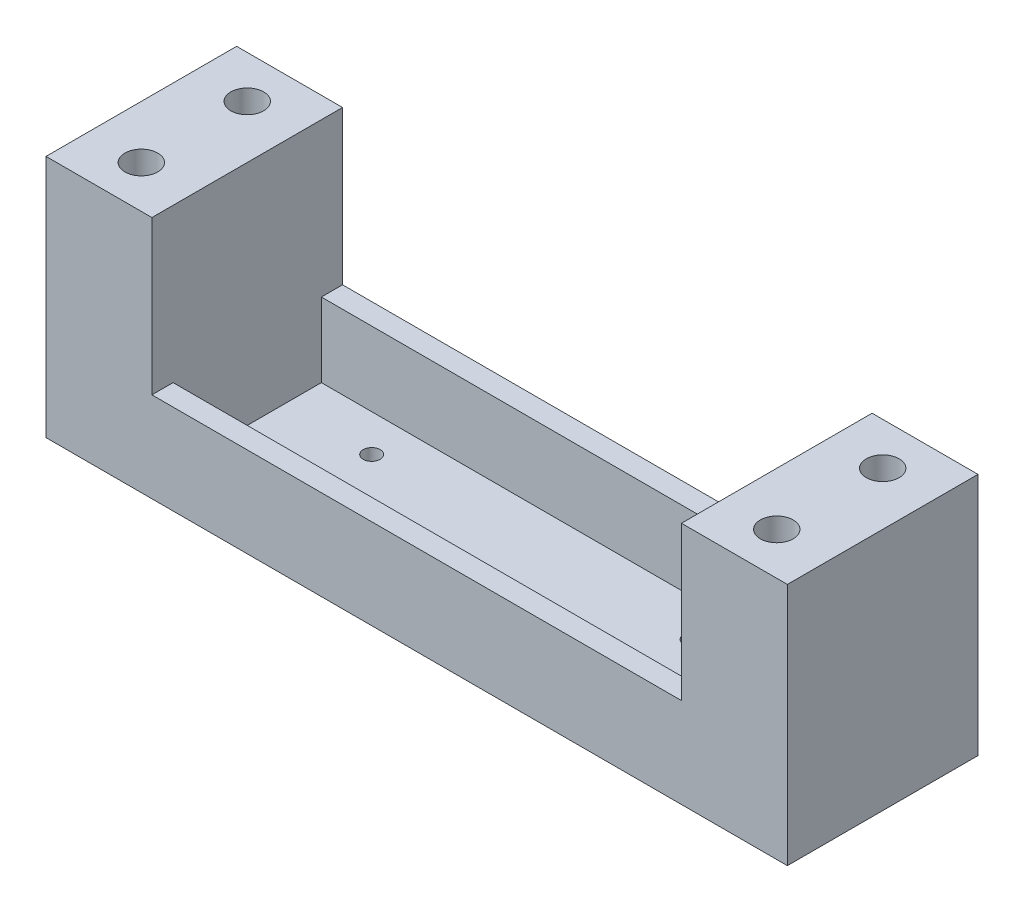
from build123d import *

# Parameters (mm, degrees)
BOSS_EXTRU_1_DEPTH      = 36
ESQUISSE6_W             = 100
ESQUISSE6_H             = 28
ENL_V_MAT_EXTRU_1_DEPTH = 14
ENL_V_MAT_EXTRU_2_REACH = 152.814
ESQUISSE7_R             = 1.6
ENL_V_MAT_EXTRU_3_REACH = 153.697
ESQUISSE8_R             = 3.1
ENL_V_MAT_EXTRU_4_DEPTH = 5.5


with BuildPart() as part:
    # Esquisse5 → Boss.-Extru.1 (new body)
    with BuildSketch(Plane.XY):
        Polygon((0, 0), (0, 46), (20, 46), (20, 17), (120, 17), (120, 46), (140, 46), (140, 0), align=None)
    extrude(amount=BOSS_EXTRU_1_DEPTH)

    # Esquisse6 → Enlèv. mat.-Extru.1 (cut)
    with BuildSketch(Plane(origin=(0, 17, 0), x_dir=(1, 0, 0), z_dir=(0, 1, 0))):
        with Locations((70, -18)):
            Rectangle(ESQUISSE6_W, ESQUISSE6_H)
    extrude(amount=-ENL_V_MAT_EXTRU_1_DEPTH, mode=Mode.SUBTRACT)

    # Esquisse7 → Enlèv. mat.-Extru.2 (cut, up to next)
    with BuildSketch(Plane(origin=(0, 3, 0), x_dir=(1, 0, 0), z_dir=(0, 1, 0)), mode=Mode.PRIVATE) as enl_v_mat_extru_2_sk1:
        with Locations(Location((36.5, -11, 0), (0, 0, 270))):
            Circle(ESQUISSE7_R)
    enl_v_mat_extru_2_tool1 = extrude(enl_v_mat_extru_2_sk1.sketch, amount=-ENL_V_MAT_EXTRU_2_REACH, mode=Mode.PRIVATE) & part.part
    # Esquisse7 → Enlèv. mat.-Extru.2 (cut, up to next)
    with BuildSketch(Plane(origin=(0, 3, 0), x_dir=(1, 0, 0), z_dir=(0, 1, 0)), mode=Mode.PRIVATE) as enl_v_mat_extru_2_sk2:
        with Locations(Location((97, -11, 0), (0, 0, 270))):
            Circle(ESQUISSE7_R)
    enl_v_mat_extru_2_tool2 = extrude(enl_v_mat_extru_2_sk2.sketch, amount=-ENL_V_MAT_EXTRU_2_REACH, mode=Mode.PRIVATE) & part.part
    # Esquisse7 → Enlèv. mat.-Extru.2 (cut, up to next)
    with BuildSketch(Plane(origin=(0, 3, 0), x_dir=(1, 0, 0), z_dir=(0, 1, 0)), mode=Mode.PRIVATE) as enl_v_mat_extru_2_sk3:
        with Locations(Location((97, -25, 0), (0, 0, 180))):
            Circle(ESQUISSE7_R)
    enl_v_mat_extru_2_tool3 = extrude(enl_v_mat_extru_2_sk3.sketch, amount=-ENL_V_MAT_EXTRU_2_REACH, mode=Mode.PRIVATE) & part.part
    # Esquisse7 → Enlèv. mat.-Extru.2 (cut, up to next)
    with BuildSketch(Plane(origin=(0, 3, 0), x_dir=(1, 0, 0), z_dir=(0, 1, 0)), mode=Mode.PRIVATE) as enl_v_mat_extru_2_sk4:
        with Locations(Location((36.5, -25, 0), (0, 0, 180))):
            Circle(ESQUISSE7_R)
    enl_v_mat_extru_2_tool4 = extrude(enl_v_mat_extru_2_sk4.sketch, amount=-ENL_V_MAT_EXTRU_2_REACH, mode=Mode.PRIVATE) & part.part
    add(enl_v_mat_extru_2_tool1.solids().sort_by_distance((36.5, 3, 11))[0], mode=Mode.SUBTRACT)
    add(enl_v_mat_extru_2_tool2.solids().sort_by_distance((97, 3, 11))[0], mode=Mode.SUBTRACT)
    add(enl_v_mat_extru_2_tool3.solids().sort_by_distance((97, 3, 25))[0], mode=Mode.SUBTRACT)
    add(enl_v_mat_extru_2_tool4.solids().sort_by_distance((36.5, 3, 25))[0], mode=Mode.SUBTRACT)

    # Esquisse8 → Enlèv. mat.-Extru.3 (cut, up to next)
    with BuildSketch(Plane(origin=(0, 46, 0), x_dir=(1, 0, 0), z_dir=(0, 1, 0)), mode=Mode.PRIVATE) as enl_v_mat_extru_3_sk1:
        with Locations(Location((10, -8, 0), (0, 0, 270))):
            Circle(ESQUISSE8_R)
    enl_v_mat_extru_3_tool1 = extrude(enl_v_mat_extru_3_sk1.sketch, amount=-ENL_V_MAT_EXTRU_3_REACH, mode=Mode.PRIVATE) & part.part
    # Esquisse8 → Enlèv. mat.-Extru.3 (cut, up to next)
    with BuildSketch(Plane(origin=(0, 46, 0), x_dir=(1, 0, 0), z_dir=(0, 1, 0)), mode=Mode.PRIVATE) as enl_v_mat_extru_3_sk2:
        with Locations(Location((10, -28, 0), (0, 0, 270))):
            Circle(ESQUISSE8_R)
    enl_v_mat_extru_3_tool2 = extrude(enl_v_mat_extru_3_sk2.sketch, amount=-ENL_V_MAT_EXTRU_3_REACH, mode=Mode.PRIVATE) & part.part
    # Esquisse8 → Enlèv. mat.-Extru.3 (cut, up to next)
    with BuildSketch(Plane(origin=(0, 46, 0), x_dir=(1, 0, 0), z_dir=(0, 1, 0)), mode=Mode.PRIVATE) as enl_v_mat_extru_3_sk3:
        with Locations(Location((130, -28, 0), (0, 0, 180))):
            Circle(ESQUISSE8_R)
    enl_v_mat_extru_3_tool3 = extrude(enl_v_mat_extru_3_sk3.sketch, amount=-ENL_V_MAT_EXTRU_3_REACH, mode=Mode.PRIVATE) & part.part
    # Esquisse8 → Enlèv. mat.-Extru.3 (cut, up to next)
    with BuildSketch(Plane(origin=(0, 46, 0), x_dir=(1, 0, 0), z_dir=(0, 1, 0)), mode=Mode.PRIVATE) as enl_v_mat_extru_3_sk4:
        with Locations(Location((130, -8, 0), (0, 0, 180))):
            Circle(ESQUISSE8_R)
    enl_v_mat_extru_3_tool4 = extrude(enl_v_mat_extru_3_sk4.sketch, amount=-ENL_V_MAT_EXTRU_3_REACH, mode=Mode.PRIVATE) & part.part
    add(enl_v_mat_extru_3_tool1.solids().sort_by_distance((10, 46, 8))[0], mode=Mode.SUBTRACT)
    add(enl_v_mat_extru_3_tool2.solids().sort_by_distance((10, 46, 28))[0], mode=Mode.SUBTRACT)
    add(enl_v_mat_extru_3_tool3.solids().sort_by_distance((130, 46, 28))[0], mode=Mode.SUBTRACT)
    add(enl_v_mat_extru_3_tool4.solids().sort_by_distance((130, 46, 8))[0], mode=Mode.SUBTRACT)

    # Esquisse9 → Enlèv. mat.-Extru.4 (cut)
    with BuildSketch(Plane.XZ):
        Polygon((124.9, 5.055513627), (130, 2.111027254), (135.1, 5.055513627), (135.1, 10.944486373), (130, 13.888972746), (124.9, 10.944486373), align=None)
        Polygon((124.9, 25.055513627), (124.9, 30.944486373), (130, 33.888972746), (135.1, 30.944486373), (135.1, 25.055513627), (130, 22.111027254), align=None)
        Polygon((15.1, 30.944486373), (10, 33.888972746), (4.9, 30.944486373), (4.9, 25.055513627), (10, 22.111027254), (15.1, 25.055513627), align=None)
        Polygon((15.1, 10.944486373), (15.1, 5.055513627), (10, 2.111027254), (4.9, 5.055513627), (4.9, 10.944486373), (10, 13.888972746), align=None)
    extrude(amount=-ENL_V_MAT_EXTRU_4_DEPTH, mode=Mode.SUBTRACT)


solid = part.part
